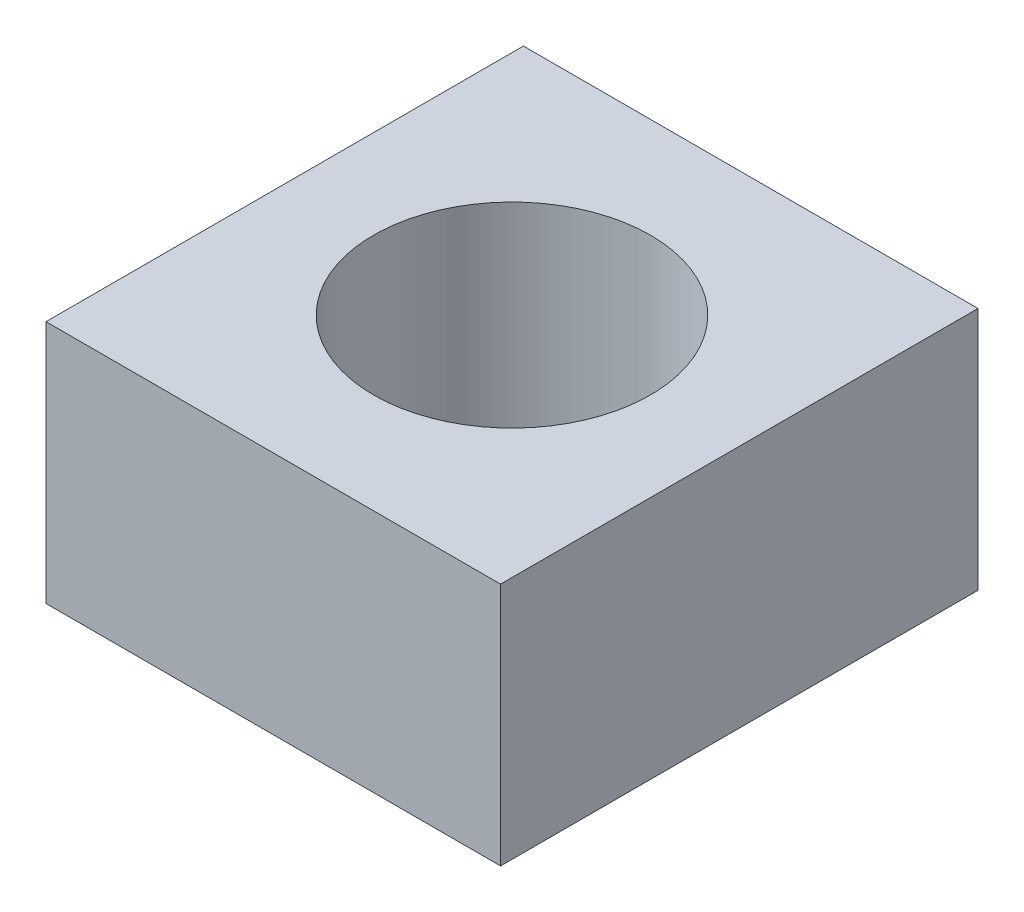
from build123d import *

# Parameters (mm, degrees)
SKETCH3_W           = 93.112965828
SKETCH3_H           = 97.794623328
SKETCH3_R           = 28.360772796
BOSS_EXTRUDE4_DEPTH = 50


with BuildPart() as part:
    # Sketch3 → Boss-Extrude4 (new body)
    with BuildSketch(Plane(origin=(0, 0, 0), x_dir=(1, 0, 0), z_dir=(0, 1, 0))):
        Rectangle(SKETCH3_W, SKETCH3_H)
        Circle(SKETCH3_R, mode=Mode.SUBTRACT)
    extrude(amount=BOSS_EXTRUDE4_DEPTH)


solid = part.part
